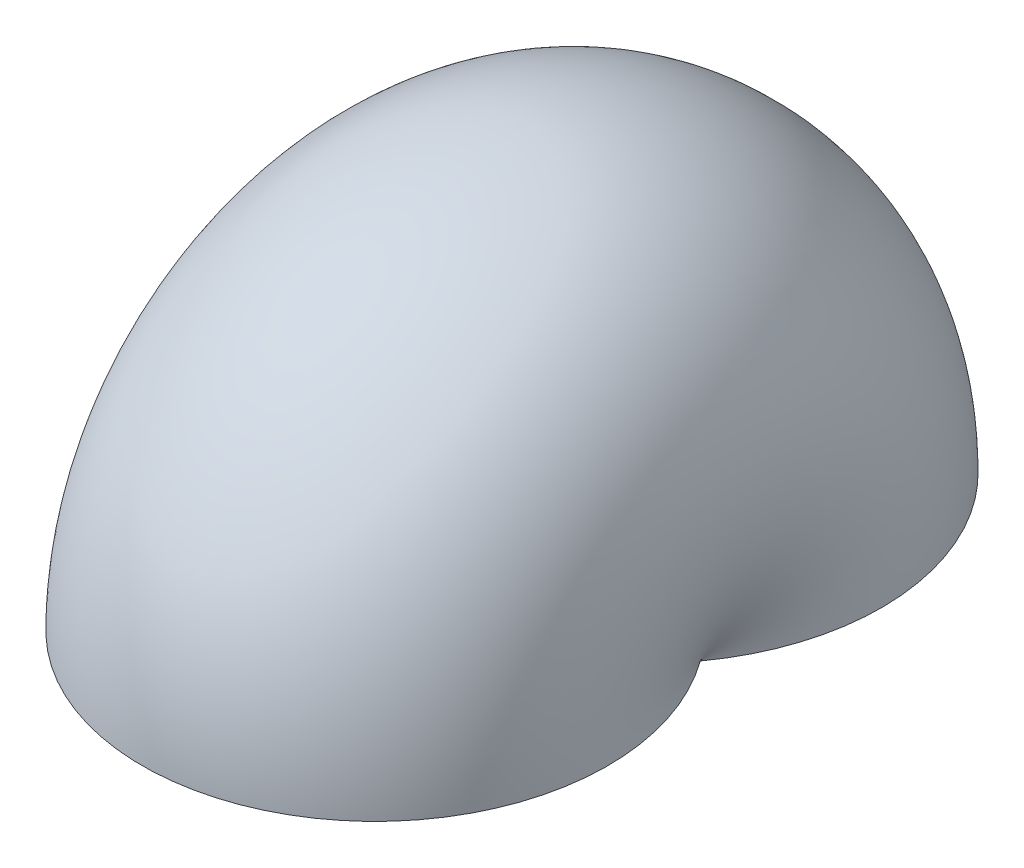
from build123d import *

# Parameters (mm, degrees)
REVOLVE14_ANGLE = 180


with BuildPart() as part:
    # Sketch1 → Revolve14 (revolve)
    with BuildSketch(Plane(origin=(0, 0, 0), x_dir=(1, 0, 0), z_dir=(0, 1, 0))):
        with BuildLine():
            ThreePointArc((135.93, 160), (-42.064856061, 289.257544401), (-109.89524512, 80))
            Line((-109.89524512, 80), (109.89524512, 80))
            ThreePointArc((109.89524512, 80), (129.257544401, 117.935143939), (135.93, 160))
        make_face()
    revolve(axis=Axis((-109.89524512, 0, -80), (1, 0, 0)), revolution_arc=REVOLVE14_ANGLE)

    # Sketch3 → Cut-Revolve1 (revolve, cut)
    with BuildSketch(Plane.XZ):
        with BuildLine():
            Line((-109.89524512, -80), (109.89524512, -80))
            ThreePointArc((109.89524512, -80), (0, -135.93), (-109.89524512, -80))
        make_face()
    revolve(axis=Axis((-109.89524512, 0, -80), (1, 0, 0)), mode=Mode.SUBTRACT)


solid = part.part
